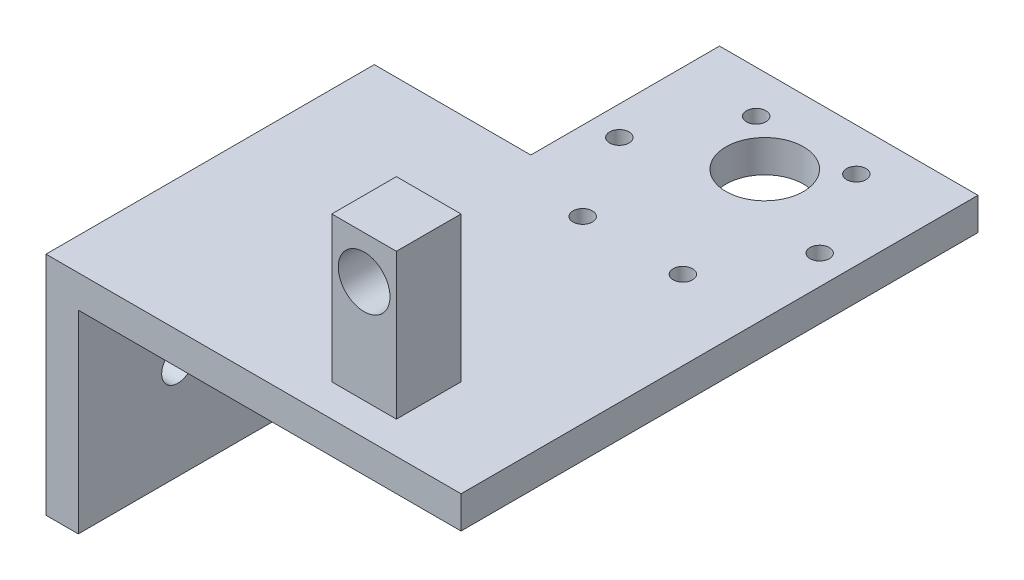
from build123d import *

# Parameters (mm, degrees)
SKETCH3_W           = 40
SKETCH3_H           = 80
BOSS_EXTRUDE1_DEPTH = 5
SKETCH1_R           = 1.5
SKETCH1_R_2         = 6
CUT_EXTRUDE3_DEPTH  = 64.442887702
SKETCH4_W           = 10
SKETCH4_H           = 10
BOSS_EXTRUDE2_DEPTH = 22.5
SKETCH5_R           = 4
CUT_EXTRUDE4_DEPTH  = 8
SKETCH6_W           = 50.8
SKETCH6_H           = 5
BOSS_EXTRUDE3_DEPTH = 24.225
SKETCH8_W           = 5
SKETCH8_H           = 50.8
BOSS_EXTRUDE4_DEPTH = 30
SKETCH9_R           = 2.5
CUT_EXTRUDE5_DEPTH  = 5


with BuildPart() as part:
    # Sketch3 → Boss-Extrude1 (new body)
    with BuildSketch(Plane(origin=(0, 0, 0), x_dir=(1, 0, 0), z_dir=(0, 1, 0))):
        with Locations((0, -20)):
            Rectangle(SKETCH3_W, SKETCH3_H)
    extrude(amount=BOSS_EXTRUDE1_DEPTH)

    # Sketch1 → Cut-Extrude3 (cut, through all)
    with BuildSketch(Plane(origin=(0, 0, 0), x_dir=(1, 0, 0), z_dir=(0, 1, 0))):
        with Locations(Location((-15.5, 0, 0), (0, 0, 270))):
            Circle(SKETCH1_R)
        with Locations(Location((-7.75, 13.423393759, 0), (0, 0, 270))):
            Circle(SKETCH1_R)
        with Locations(Location((7.75, 13.423393759, 0), (0, 0, 270))):
            Circle(SKETCH1_R)
        with Locations(Location((15.5, 0, 0), (0, 0, 270))):
            Circle(SKETCH1_R)
        with Locations(Location((7.75, -13.423393759, 0), (0, 0, 270))):
            Circle(SKETCH1_R)
        with Locations(Location((-7.75, -13.423393759, 0), (0, 0, 270))):
            Circle(SKETCH1_R)
        with Locations(Location((0, 7, 0), (0, 0, 270))):
            Circle(SKETCH1_R_2)
    extrude(amount=CUT_EXTRUDE3_DEPTH, mode=Mode.SUBTRACT)

    # Sketch4 → Boss-Extrude2 (add)
    with BuildSketch(Plane(origin=(0, 5, 0), x_dir=(1, 0, 0), z_dir=(0, 1, 0))):
        with Locations((0, -50)):
            Rectangle(SKETCH4_W, SKETCH4_H)
    extrude(amount=BOSS_EXTRUDE2_DEPTH)

    # Sketch5 → Cut-Extrude4 (cut)
    with BuildSketch(Plane.XY.offset(55)):
        with Locations((0, 20.9)):
            Circle(SKETCH5_R)
    extrude(amount=-CUT_EXTRUDE4_DEPTH, mode=Mode.SUBTRACT)

    # Sketch6 → Boss-Extrude3 (add)
    with BuildSketch(Plane.ZY.offset(20)):
        with Locations((34.6, 2.5)):
            Rectangle(SKETCH6_W, SKETCH6_H)
    extrude(amount=BOSS_EXTRUDE3_DEPTH)

    # Sketch8 → Boss-Extrude4 (add)
    with BuildSketch(Plane.XZ):
        with Locations((-41.725, 34.6)):
            Rectangle(SKETCH8_W, SKETCH8_H)
    extrude(amount=BOSS_EXTRUDE4_DEPTH)

    # Sketch9 → Cut-Extrude5 (cut)
    with BuildSketch(Plane.ZY.offset(44.225)):
        with Locations((44.6, -15)):
            Circle(SKETCH9_R)
        with Locations((24.6, -15)):
            Circle(SKETCH9_R)
    extrude(amount=-CUT_EXTRUDE5_DEPTH, mode=Mode.SUBTRACT)


solid = part.part
